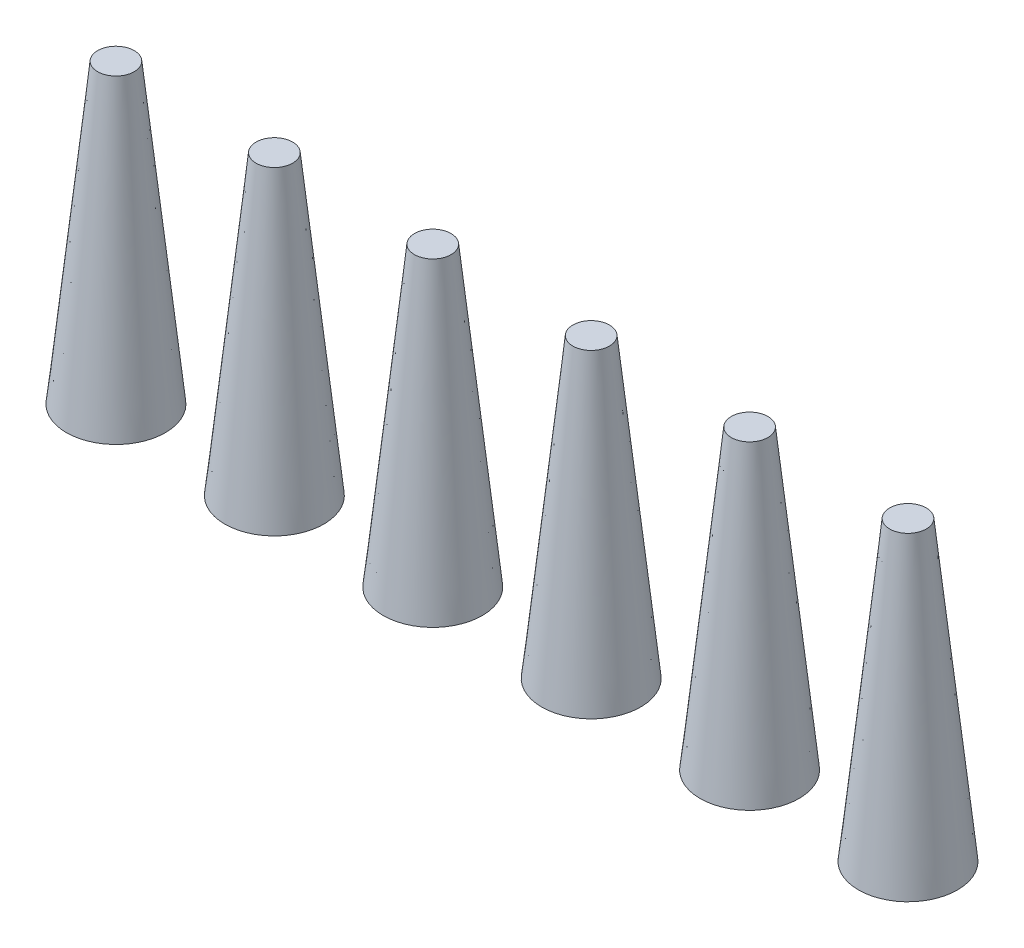
from build123d import *

# Parameters (mm, degrees)
SKETCH1_R                     = 2.5
BOSS_EXTRUDE1_DEPTH           = 15
BOSS_EXTRUDE1_DRAFT           = 6
BOSS_EXTRUDE1_PROFILE_2_DEPTH = 15
BOSS_EXTRUDE1_PROFILE_2_DRAFT = 6
BOSS_EXTRUDE1_PROFILE_3_DEPTH = 15
BOSS_EXTRUDE1_PROFILE_3_DRAFT = 6
BOSS_EXTRUDE1_PROFILE_4_DEPTH = 15
BOSS_EXTRUDE1_PROFILE_4_DRAFT = 6
BOSS_EXTRUDE1_PROFILE_5_DEPTH = 15
BOSS_EXTRUDE1_PROFILE_5_DRAFT = 6
BOSS_EXTRUDE1_PROFILE_6_DEPTH = 15
BOSS_EXTRUDE1_PROFILE_6_DRAFT = 6


with BuildPart() as part:
    # Sketch1 → Boss-Extrude1 (with draft: the straight prism first)
    with BuildSketch(Plane(origin=(0, 0, 0), x_dir=(1, 0, 0), z_dir=(0, 1, 0))):
        Circle(SKETCH1_R)
    extrude(amount=BOSS_EXTRUDE1_DEPTH)
    # Boss-Extrude1: the draft: its side faces are tilted about the plane it starts from
    boss_extrude1_sides = [part.faces().sort_by_distance(p)[0] for p in [
        (-2.5, 7.5, 0),
    ]]
    draft(boss_extrude1_sides, Plane(origin=(0, 0, 0), x_dir=(1, 0, 0), z_dir=(0, 1, 0)), BOSS_EXTRUDE1_DRAFT)


with BuildPart() as body_2:
    # Sketch1 → Boss-Extrude1 profile 2 (with draft: the straight prism first)
    with BuildSketch(Plane(origin=(0, 0, 0), x_dir=(1, 0, 0), z_dir=(0, 1, 0))):
        with Locations((8, 0)):
            Circle(SKETCH1_R)
    extrude(amount=BOSS_EXTRUDE1_PROFILE_2_DEPTH)
    # Boss-Extrude1 profile 2: the draft: its side faces are tilted about the plane it starts from
    boss_extrude1_profile_2_sides = [body_2.faces().sort_by_distance(p)[0] for p in [
        (5.5, 7.5, 0),
    ]]
    draft(boss_extrude1_profile_2_sides, Plane(origin=(0, 0, 0), x_dir=(1, 0, 0), z_dir=(0, 1, 0)), BOSS_EXTRUDE1_PROFILE_2_DRAFT)


with BuildPart() as body_3:
    # Sketch1 → Boss-Extrude1 profile 3 (with draft: the straight prism first)
    with BuildSketch(Plane(origin=(0, 0, 0), x_dir=(1, 0, 0), z_dir=(0, 1, 0))):
        with Locations((16, 0)):
            Circle(SKETCH1_R)
    extrude(amount=BOSS_EXTRUDE1_PROFILE_3_DEPTH)
    # Boss-Extrude1 profile 3: the draft: its side faces are tilted about the plane it starts from
    boss_extrude1_profile_3_sides = [body_3.faces().sort_by_distance(p)[0] for p in [
        (13.5, 7.5, 0),
    ]]
    draft(boss_extrude1_profile_3_sides, Plane(origin=(0, 0, 0), x_dir=(1, 0, 0), z_dir=(0, 1, 0)), BOSS_EXTRUDE1_PROFILE_3_DRAFT)


with BuildPart() as body_4:
    # Sketch1 → Boss-Extrude1 profile 4 (with draft: the straight prism first)
    with BuildSketch(Plane(origin=(0, 0, 0), x_dir=(1, 0, 0), z_dir=(0, 1, 0))):
        with Locations((24, 0)):
            Circle(SKETCH1_R)
    extrude(amount=BOSS_EXTRUDE1_PROFILE_4_DEPTH)
    # Boss-Extrude1 profile 4: the draft: its side faces are tilted about the plane it starts from
    boss_extrude1_profile_4_sides = [body_4.faces().sort_by_distance(p)[0] for p in [
        (21.5, 7.5, 0),
    ]]
    draft(boss_extrude1_profile_4_sides, Plane(origin=(0, 0, 0), x_dir=(1, 0, 0), z_dir=(0, 1, 0)), BOSS_EXTRUDE1_PROFILE_4_DRAFT)


with BuildPart() as body_5:
    # Sketch1 → Boss-Extrude1 profile 5 (with draft: the straight prism first)
    with BuildSketch(Plane(origin=(0, 0, 0), x_dir=(1, 0, 0), z_dir=(0, 1, 0))):
        with Locations((32, 0)):
            Circle(SKETCH1_R)
    extrude(amount=BOSS_EXTRUDE1_PROFILE_5_DEPTH)
    # Boss-Extrude1 profile 5: the draft: its side faces are tilted about the plane it starts from
    boss_extrude1_profile_5_sides = [body_5.faces().sort_by_distance(p)[0] for p in [
        (29.5, 7.5, 0),
    ]]
    draft(boss_extrude1_profile_5_sides, Plane(origin=(0, 0, 0), x_dir=(1, 0, 0), z_dir=(0, 1, 0)), BOSS_EXTRUDE1_PROFILE_5_DRAFT)


with BuildPart() as body_6:
    # Sketch1 → Boss-Extrude1 profile 6 (with draft: the straight prism first)
    with BuildSketch(Plane(origin=(0, 0, 0), x_dir=(1, 0, 0), z_dir=(0, 1, 0))):
        with Locations((40, 0)):
            Circle(SKETCH1_R)
    extrude(amount=BOSS_EXTRUDE1_PROFILE_6_DEPTH)
    # Boss-Extrude1 profile 6: the draft: its side faces are tilted about the plane it starts from
    boss_extrude1_profile_6_sides = [body_6.faces().sort_by_distance(p)[0] for p in [
        (37.5, 7.5, 0),
    ]]
    draft(boss_extrude1_profile_6_sides, Plane(origin=(0, 0, 0), x_dir=(1, 0, 0), z_dir=(0, 1, 0)), BOSS_EXTRUDE1_PROFILE_6_DRAFT)


solid = Compound([part.part, body_2.part, body_3.part, body_4.part, body_5.part, body_6.part])
